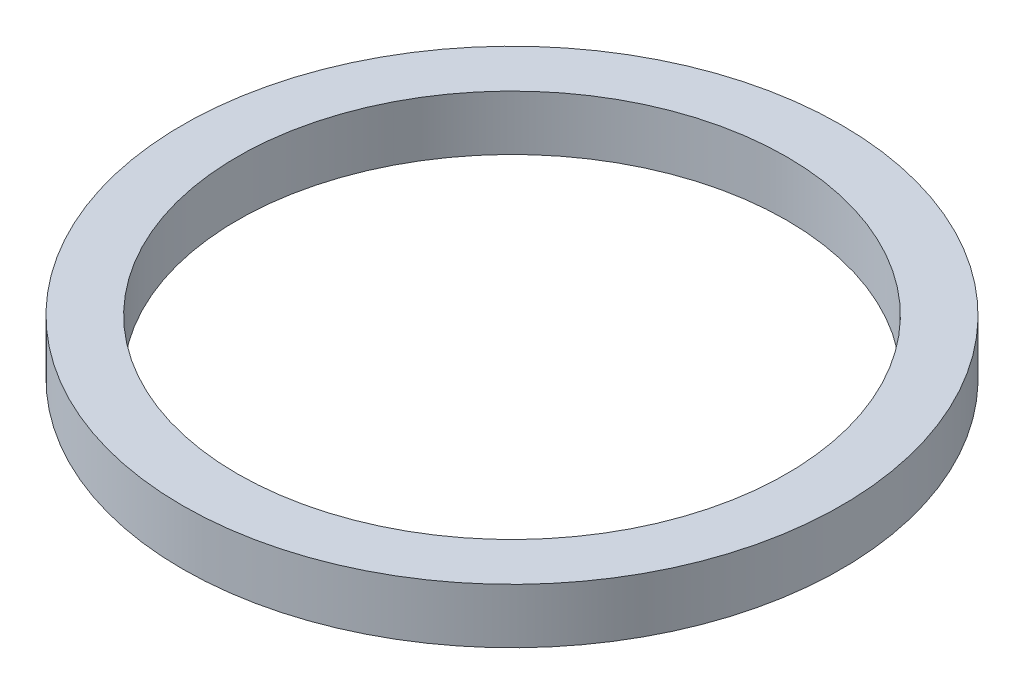
from build123d import *

# Parameters (mm, degrees)
BOSS_EXTRUDE1_DEPTH      = 0.05
BOSS_EXTRUDE1_DEPTH_BACK = 0.05
SKETCH2_R                = 0.6
SKETCH2_R_2              = 0.5


with BuildPart() as part:
    # Sketch2 → Boss-Extrude1 (new, two sides: drawn at the far end of the back side and taken through both)
    with BuildSketch(Plane(origin=(0, 0, 0), x_dir=(1, 0, 0), z_dir=(0, 1, 0)).offset(-BOSS_EXTRUDE1_DEPTH_BACK)):
        Circle(SKETCH2_R)
        Circle(SKETCH2_R_2, mode=Mode.SUBTRACT)
    extrude(amount=BOSS_EXTRUDE1_DEPTH + BOSS_EXTRUDE1_DEPTH_BACK)


solid = part.part
